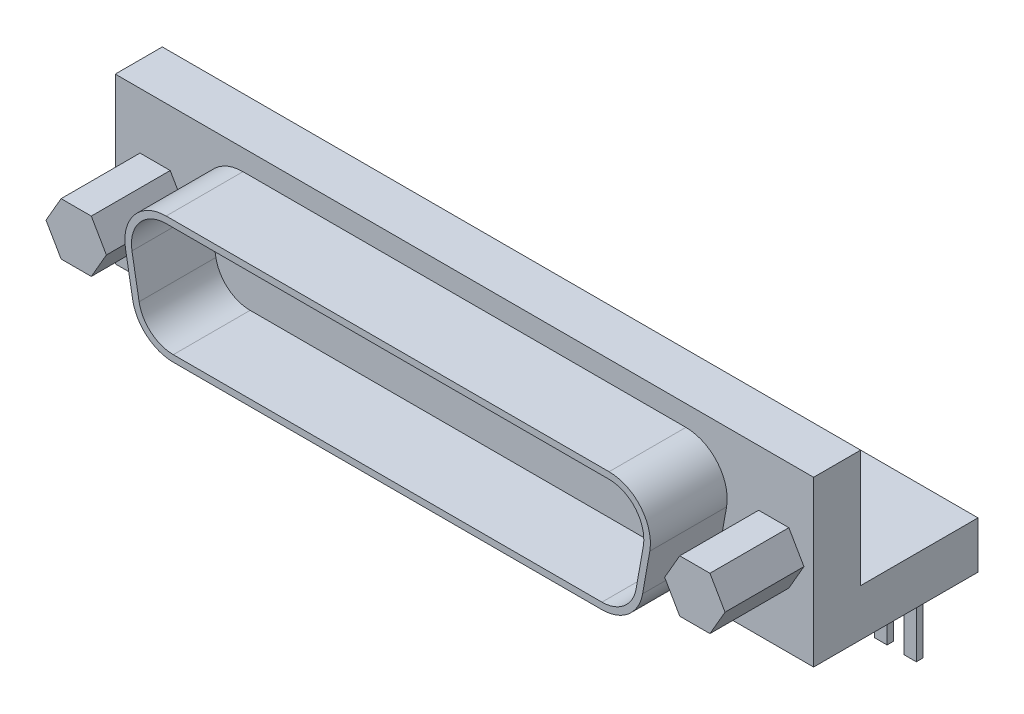
from build123d import *

# Parameters (mm, degrees)
BOSS_EXTRUDE1_DEPTH = 53.1
SKETCH3_W           = 0.955506131
SKETCH3_H           = 0.5
BOSS_EXTRUDE3_DEPTH = 5
BOSS_EXTRUDE4_DEPTH = 6
BOSS_EXTRUDE5_DEPTH = 5.84


with BuildPart() as part:
    # Sketch1 → Boss-Extrude1 (new body)
    with BuildSketch(Plane(origin=(0, 0, 0), x_dir=(0, 0, -1), z_dir=(1, 0, 0))):
        Polygon((0, 0), (12.5, 0), (12.5, 3.577441077), (3.577441077, 3.577441077), (3.577441077, 12.5), (0, 12.5), align=None)
    extrude(amount=BOSS_EXTRUDE1_DEPTH)

    # Sketch3 → Boss-Extrude3 (add)
    with BuildSketch(Plane.XZ):
        with Locations((1.917753066, -9.5)):
            Rectangle(SKETCH3_W, SKETCH3_H)
        with Locations((4.142246935, -9.5)):
            Rectangle(SKETCH3_W, SKETCH3_H)
        with Locations((48.957753066, -9.5)):
            Rectangle(SKETCH3_W, SKETCH3_H)
        with Locations((51.182246935, -9.5)):
            Rectangle(SKETCH3_W, SKETCH3_H)
    extrude(amount=BOSS_EXTRUDE3_DEPTH)

    # Sketch4 → Boss-Extrude4 (add)
    with BuildSketch(Plane.XY):
        Polygon((4.177995884, 4.261612802), (5.325991768, 6.25), (4.177995884, 8.238387198), (1.882004116, 8.238387198), (0.734008232, 6.25), (1.882004116, 4.261612802), align=None)
        Polygon((51.217995884, 4.261612802), (52.365991768, 6.25), (51.217995884, 8.238387198), (48.922004116, 8.238387198), (47.774008232, 6.25), (48.922004116, 4.261612802), align=None)
    extrude(amount=BOSS_EXTRUDE4_DEPTH)

    # Sketch6 → Boss-Extrude5 (add)
    with BuildSketch(Plane.XY):
        with BuildLine():
            Line((9.7116, 10.93), (43.3884, 10.93))
            ThreePointArc((43.3884, 10.93), (45.795005223, 9.807781555), (46.482272037, 7.242866885))
            Line((46.482272037, 7.242866885), (45.939749183, 4.166066885))
            ThreePointArc((45.939749183, 4.166066885), (44.8652587, 2.304994777), (42.845877146, 1.57))
            Line((42.845877146, 1.57), (10.254122854, 1.57))
            ThreePointArc((10.254122854, 1.57), (8.2347413, 2.304994777), (7.160250817, 4.166066885))
            Line((7.160250817, 4.166066885), (6.617727963, 7.242866885))
            ThreePointArc((6.617727963, 7.242866885), (7.304994777, 9.807781555), (9.7116, 10.93))
        make_face()
        with BuildLine():
            Line((9.7116, 10.43), (43.3884, 10.43))
            ThreePointArc((43.3884, 10.43), (45.411983001, 9.48638775), (45.98986816, 7.329690974))
            Line((45.98986816, 7.329690974), (45.447345306, 4.252890974))
            ThreePointArc((45.447345306, 4.252890974), (44.543864896, 2.688016999), (42.845877146, 2.07))
            Line((42.845877146, 2.07), (10.254122854, 2.07))
            ThreePointArc((10.254122854, 2.07), (8.556135104, 2.688016999), (7.652654694, 4.252890974))
            Line((7.652654694, 4.252890974), (7.11013184, 7.329690974))
            ThreePointArc((7.11013184, 7.329690974), (7.688016999, 9.48638775), (9.7116, 10.43))
        make_face(mode=Mode.SUBTRACT)
    extrude(amount=BOSS_EXTRUDE5_DEPTH)


solid = part.part
